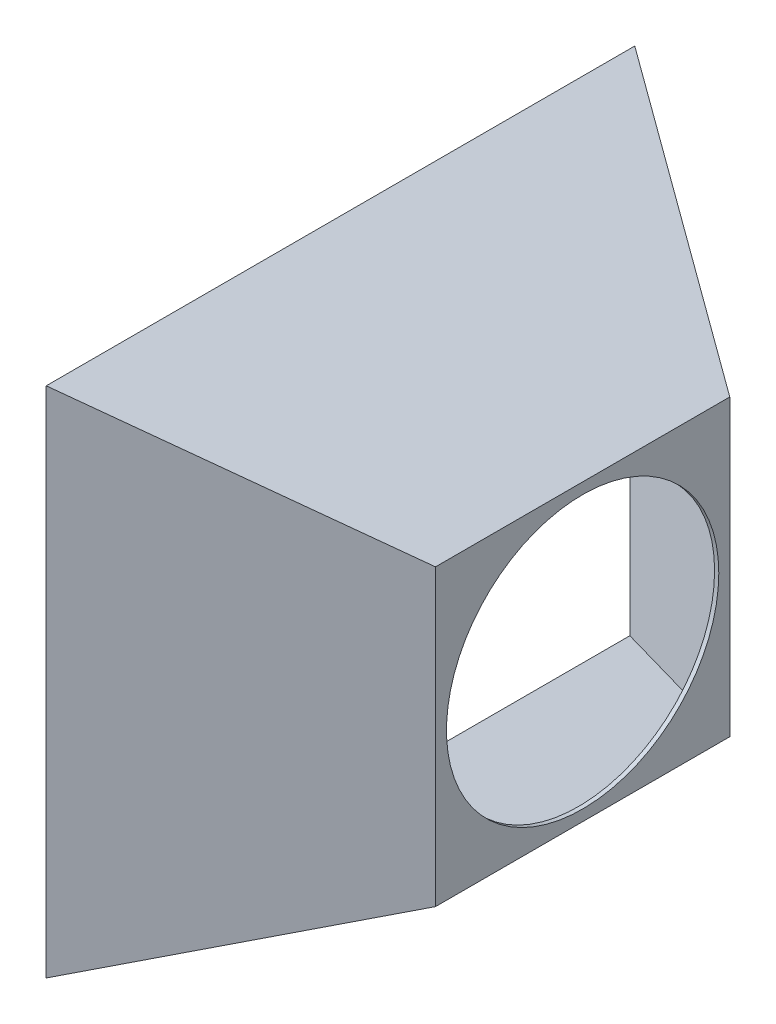
from build123d import *

# Parameters (mm, degrees)
SHELL1_T           = -5
SKETCH3_R          = 161.95
CUT_EXTRUDE1_DEPTH = 10


with BuildPart() as part:
    # Sketch1 → Loft1 section 0
    with BuildSketch(Plane(origin=(0, 0, 0), x_dir=(0, 0, -1), z_dir=(1, 0, 0))):
        with BuildLine():
            Line((350, -305), (-350, -305))
            Line((-350, -305), (-350, 305))
            Line((-350, 305), (350, 305))
            Line((350, 305), (350, -305))
        make_face()
    # Sketch2 → Loft1 section 1
    with BuildSketch(Plane(origin=(288, 0, 0), x_dir=(0, 0, -1), z_dir=(1, 0, 0))):
        with BuildLine():
            Line((175, -175), (-175, -175))
            Line((-175, -175), (-175, 175))
            Line((-175, 175), (175, 175))
            Line((175, 175), (175, -175))
        make_face()
    loft()

    # Shell1
    shell1_openings = [part.faces().sort_by_distance(p)[0] for p in [
        (0, 0, 0),
    ]]
    offset(amount=SHELL1_T, openings=shell1_openings, kind=Kind.INTERSECTION)

    # Sketch3 → Cut-Extrude1 (cut)
    with BuildSketch(Plane(origin=(288, 0, 0), x_dir=(0, 0, -1), z_dir=(1, 0, 0))):
        Circle(SKETCH3_R)
    extrude(amount=-CUT_EXTRUDE1_DEPTH, mode=Mode.SUBTRACT)


solid = part.part
